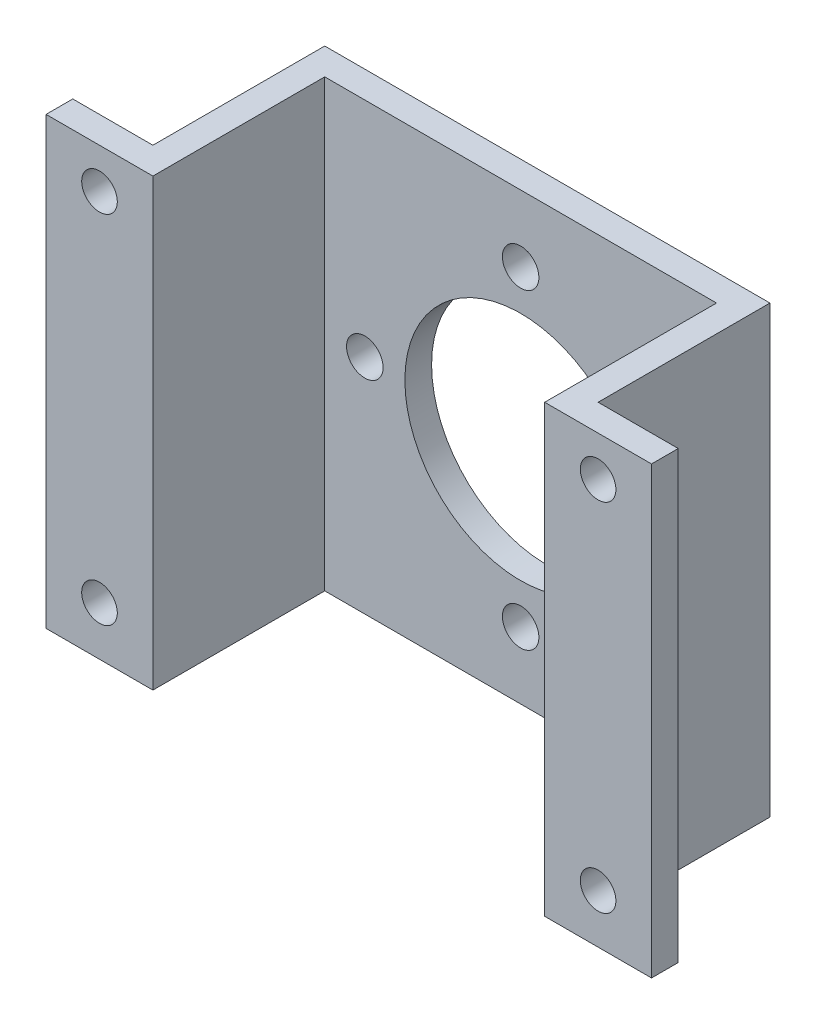
from build123d import *

# Parameters (mm, degrees)
EXTRUDE_1_DEPTH     = 25
SKETCH_3_R          = 13
SKETCH_3_R_2        = 2.05
CUT_EXTRUDE_1_DEPTH = 50
SKETCH_4_R          = 2
CUT_EXTRUDE_2_DEPTH = 10


with BuildPart() as part:
    # 草图2 → 凸台-拉伸1 (new, symmetric)
    with BuildSketch(Plane(origin=(0, 0, 0), x_dir=(1, 0, 0), z_dir=(0, 1, 0))):
        Polygon((-22, -19.3), (-22, 0), (22, 0), (22, -19.3), (34, -19.3), (34, -16.3), (25, -16.3), (25, 3), (-25, 3), (-25, -16.3), (-34, -16.3), (-34, -19.3), align=None)
    extrude(amount=EXTRUDE_1_DEPTH, both=True)

    # 草图3 → 切除-拉伸1 (cut)
    with BuildSketch(Plane(origin=(0, 0, -3), x_dir=(-1, 0, 0), z_dir=(0, 0, -1))):
        Circle(SKETCH_3_R)
        with Locations((0, 17.5)):
            Circle(SKETCH_3_R_2)
        with Locations((-17.5, 0)):
            Circle(SKETCH_3_R_2)
        with Locations((17.5, 0)):
            Circle(SKETCH_3_R_2)
        with Locations((0, -17.5)):
            Circle(SKETCH_3_R_2)
    extrude(amount=-CUT_EXTRUDE_1_DEPTH, mode=Mode.SUBTRACT)

    # 草图4 → 切除-拉伸2 (cut)
    with BuildSketch(Plane(origin=(0, 0, 16.3), x_dir=(-1, 0, 0), z_dir=(0, 0, -1))):
        with Locations((28, 20.5)):
            Circle(SKETCH_4_R)
        with Locations((28, -19.5)):
            Circle(SKETCH_4_R)
        with Locations((-28, 20.5)):
            Circle(SKETCH_4_R)
        with Locations((-28, -19.5)):
            Circle(SKETCH_4_R)
    extrude(amount=-CUT_EXTRUDE_2_DEPTH, mode=Mode.SUBTRACT)


solid = part.part
